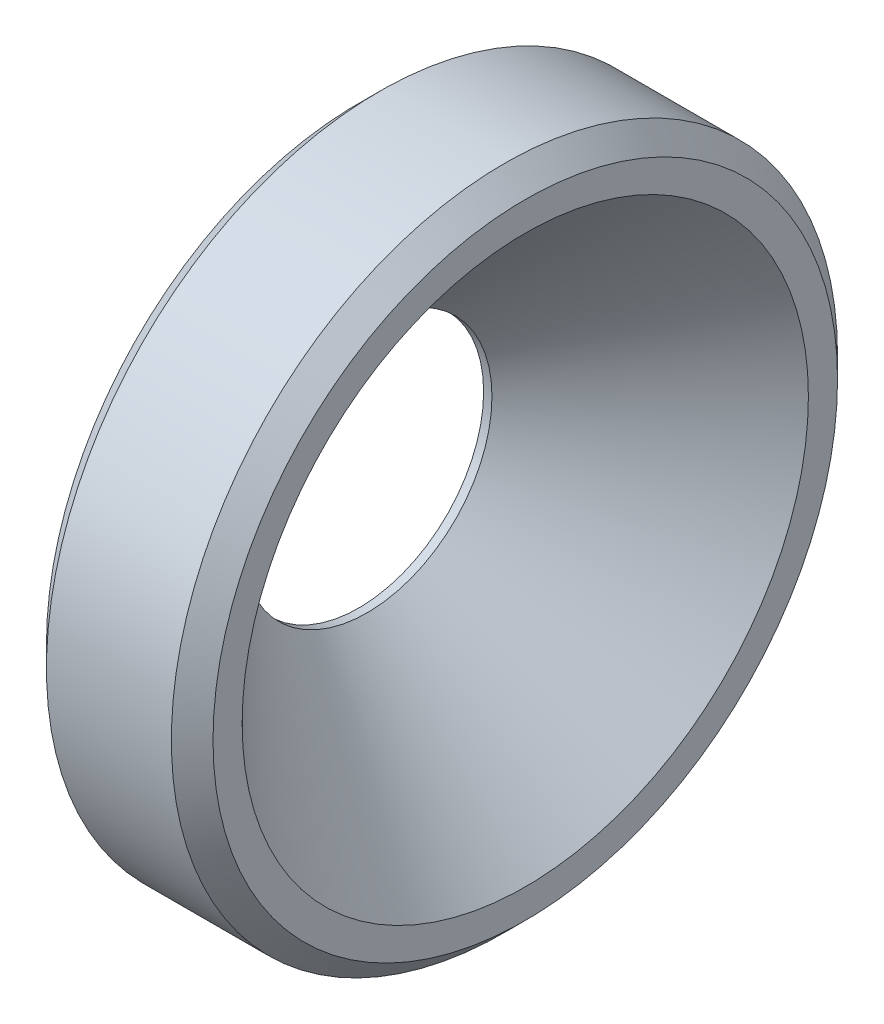
from build123d import *

# Parameters (mm, degrees)
SKETCH1_R           = 4
SKETCH1_R_2         = 1.5
BOSS_EXTRUDE1_DEPTH = 2
CHAMFER1_SIZE       = 1.9
CHAMFER2_SIZE       = 0.25


with BuildPart() as part:
    # Sketch1 → Boss-Extrude1 (new body)
    with BuildSketch(Plane(origin=(0, 0, 0), x_dir=(0, 0, -1), z_dir=(1, 0, 0))):
        Circle(SKETCH1_R)
        Circle(SKETCH1_R_2, mode=Mode.SUBTRACT)
    extrude(amount=BOSS_EXTRUDE1_DEPTH)

    # Chamfer1
    chamfer1_edges = [part.edges().sort_by_distance(p)[0] for p in [
        (2, 0, 1.5),
    ]]
    chamfer(chamfer1_edges, length=CHAMFER1_SIZE)

    # Chamfer2
    chamfer2_edges = [part.edges().sort_by_distance(p)[0] for p in [
        (0, 0, 4),
        (2, 0, 4),
    ]]
    chamfer(chamfer2_edges, length=CHAMFER2_SIZE)


solid = part.part
